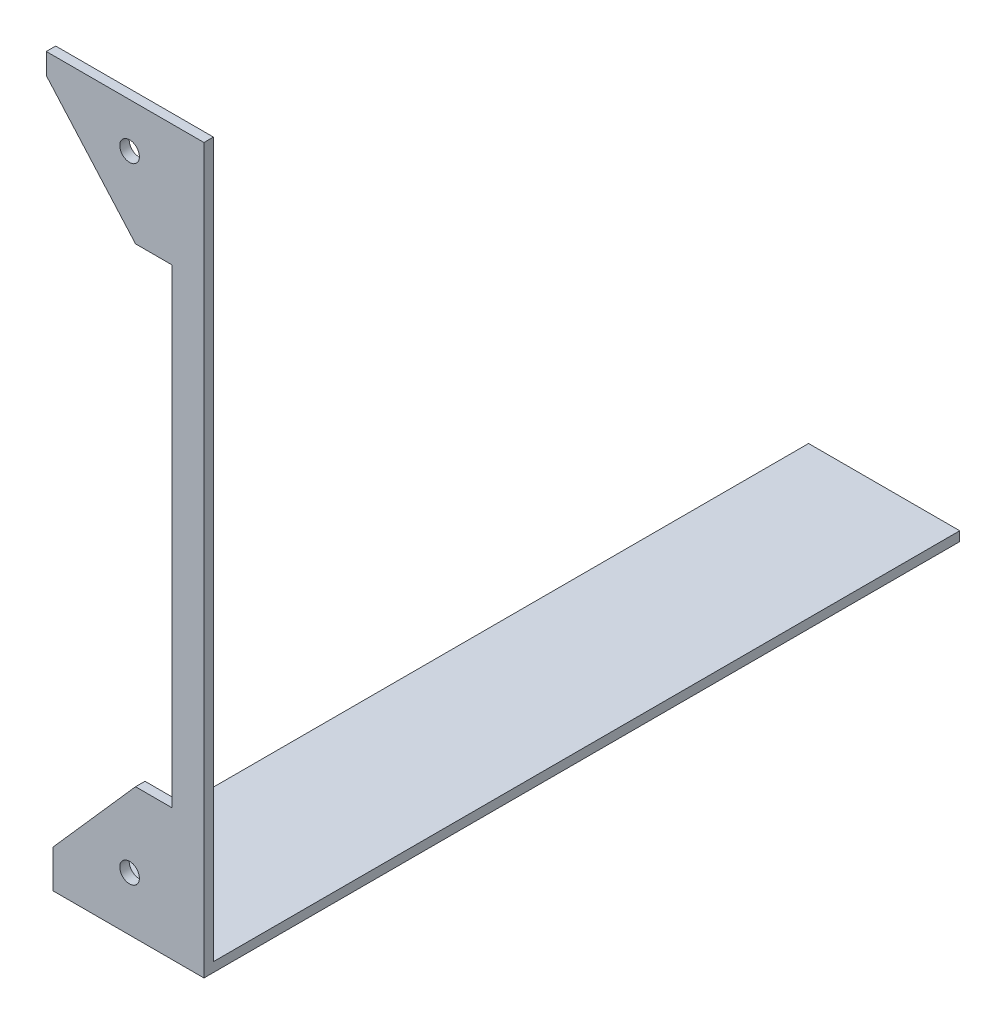
from build123d import *

# Parameters (mm, degrees)
BOSS_EXTRUDE1_DEPTH = 1.5875
SKETCH2_W           = 25.4
SKETCH2_H           = 127
BOSS_EXTRUDE2_DEPTH = 1.5875


with BuildPart() as part:
    # Sketch1 → Boss-Extrude1 (new body)
    with BuildSketch(Plane.XY):
        Polygon((0, 120), (-26.5, 120), (-26.5, 116.5), (-11.5, 99.5), (-5.4, 99.5), (-5.4, 20.5), (-11.5, 20.5), (-25.4, 4.746666667), (-25.4, 0), (0, 0), align=None)
        with BuildLine():
            ThreePointArc((-10.85, 7.5), (-12.5, 5.85), (-14.15, 7.5))
            ThreePointArc((-14.15, 7.5), (-12.5, 9.15), (-10.85, 7.5))
        make_face(mode=Mode.SUBTRACT)
        with BuildLine():
            ThreePointArc((-10.85, 112.5), (-12.5, 110.85), (-14.15, 112.5))
            ThreePointArc((-14.15, 112.5), (-12.5, 114.15), (-10.85, 112.5))
        make_face(mode=Mode.SUBTRACT)
    extrude(amount=BOSS_EXTRUDE1_DEPTH)

    # Sketch2 → Boss-Extrude2 (add)
    with BuildSketch(Plane(origin=(0, 0, 0), x_dir=(1, 0, 0), z_dir=(0, 1, 0))):
        with Locations((-12.7, 61.9125)):
            Rectangle(SKETCH2_W, SKETCH2_H)
    extrude(amount=-BOSS_EXTRUDE2_DEPTH)


solid = part.part
